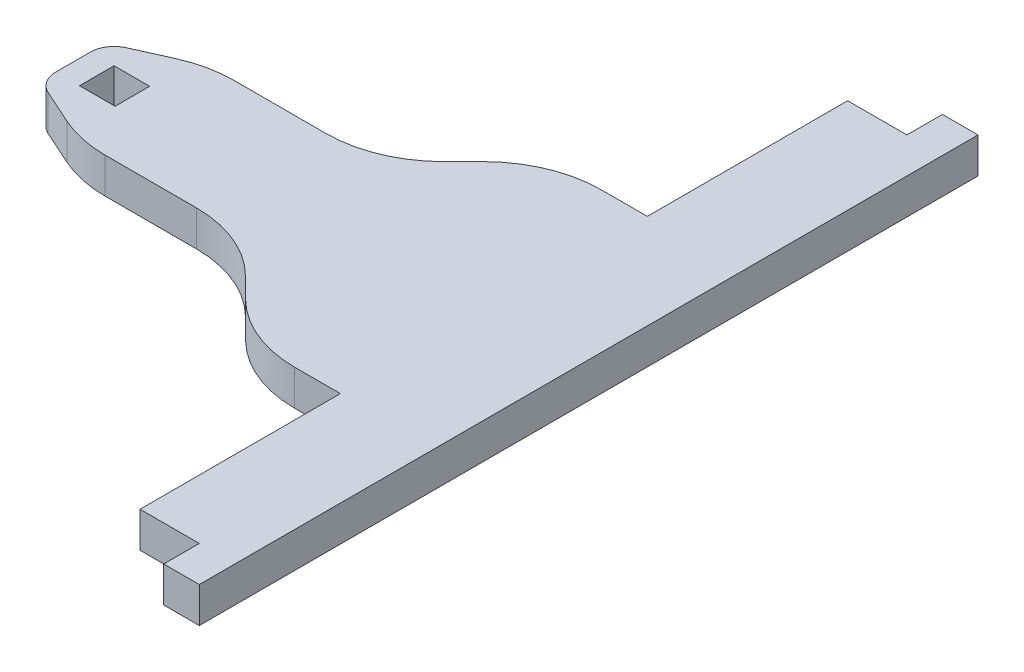
from build123d import *

# Parameters (mm, degrees)
SKETCH1_W           = 3
SKETCH1_H           = 2.91365756
BOSS_EXTRUDE1_DEPTH = 3


with BuildPart() as part:
    # Sketch1 → Boss-Extrude1 (new body)
    with BuildSketch(Plane(origin=(0, 0, 0), x_dir=(1, 0, 0), z_dir=(0, 1, 0))):
        with BuildLine():
            Line((-8, -45.8), (-11.857864376, -45.8))
            ThreePointArc((-11.857864376, -45.8), (-15.6846987, -45.038795325), (-18.928932188, -42.871067812))
            Line((-18.928932188, -42.871067812), (-20.571067812, -41.228932188))
            ThreePointArc((-20.571067812, -41.228932188), (-23.8153013, -39.061204675), (-27.642135624, -38.3))
            Line((-27.642135624, -38.3), (-35.353653112, -38.3))
            ThreePointArc((-35.353653112, -38.3), (-37.452206123, -38.077324545), (-39.457299885, -37.419215052))
            Line((-39.457299885, -37.419215052), (-42.320729355, -36.13067179))
            ThreePointArc((-42.320729355, -36.13067179), (-43.179502711, -35.392771065), (-43.5, -34.30682878))
            Line((-43.5, -34.30682878), (-43.5, -31.39317122))
            ThreePointArc((-43.5, -31.39317122), (-43.179502711, -30.307228935), (-42.320729355, -29.56932821))
            Line((-42.320729355, -29.56932821), (-39.457299885, -28.280784948))
            ThreePointArc((-39.457299885, -28.280784948), (-37.452206123, -27.622675455), (-35.353653112, -27.4))
            Line((-35.353653112, -27.4), (-27.642135624, -27.4))
            ThreePointArc((-27.642135624, -27.4), (-23.8153013, -26.638795325), (-20.571067812, -24.471067812))
            Line((-20.571067812, -24.471067812), (-18.928932188, -22.828932188))
            ThreePointArc((-18.928932188, -22.828932188), (-15.6846987, -20.661204675), (-11.857864376, -19.9))
            Line((-11.857864376, -19.9), (-8, -19.9))
            Line((-8, -19.9), (-8, -3))
            Line((-8, -3), (-3, -3))
            Line((-3, -3), (-3, 0))
            Line((-3, 0), (0, 0))
            Line((0, 0), (0, -65.7))
            Line((0, -65.7), (-3, -65.7))
            Line((-3, -65.7), (-3, -62.7))
            Line((-3, -62.7), (-8, -62.7))
            Line((-8, -62.7), (-8, -45.8))
        make_face()
        with Locations((-40, -32.85)):
            Rectangle(SKETCH1_W, SKETCH1_H, mode=Mode.SUBTRACT)
    extrude(amount=BOSS_EXTRUDE1_DEPTH)


solid = part.part
